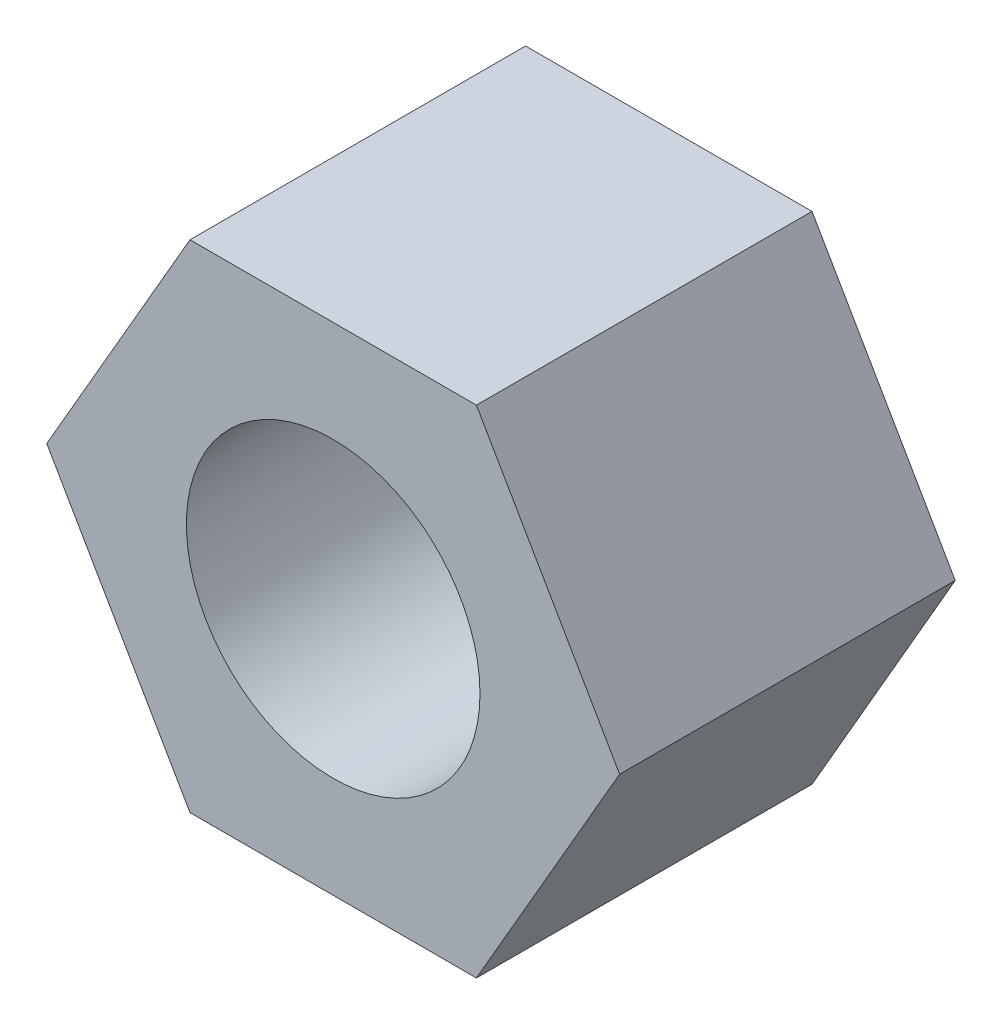
from build123d import *

# Parameters (mm, degrees)
S01_HEXAGON_AND_NOMINAL_THREAD_ENVELOP_R       = 5.03
F_01_HEXAGON_AND_NOMINAL_THREAD_ENVELOPE_DEPTH = 11.5


with BuildPart() as part:
    # S01 - Hexagon and nominal thread envelope → 01 - Hexagon and nominal thread envelope (new body)
    with BuildSketch(Plane.XY):
        Polygon((9.814954576, 0), (4.907477288, 8.5), (-4.907477288, 8.5), (-9.814954576, 0), (-4.907477288, -8.5), (4.907477288, -8.5), align=None)
        Circle(S01_HEXAGON_AND_NOMINAL_THREAD_ENVELOP_R, mode=Mode.SUBTRACT)
    extrude(amount=F_01_HEXAGON_AND_NOMINAL_THREAD_ENVELOPE_DEPTH)


solid = part.part
